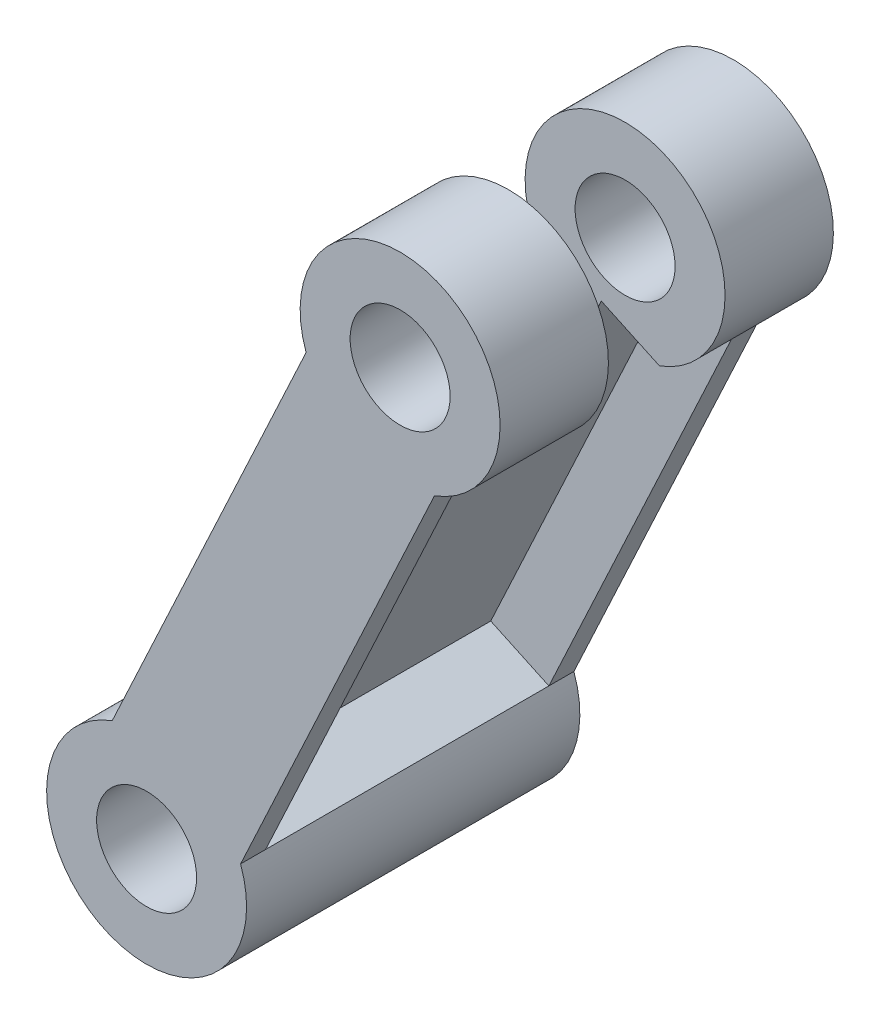
from build123d import *

# Parameters (mm, degrees)
BOSS_EXTRUDE1_DEPTH     = 100
CUT_EXTRUDE1_DEPTH      = 452.895569028
CUT_EXTRUDE1_DEPTH_BACK = 452.895569028
SKETCH2_R               = 30
SKETCH9_R               = 60
CUT_EXTRUDE4_DEPTH      = 35
CUT_EXTRUDE5_DEPTH      = 457.59902747
SKETCH12_W              = 170
SKETCH12_H              = 275.29462827
CUT_EXTRUDE6_DEPTH      = 38.5


with BuildPart() as part:
    # Sketch1 → Boss-Extrude1 (new, symmetric)
    with BuildSketch(Plane.XY):
        with BuildLine():
            Line((56.417099429, 20.423292878), (172.761636695, 269.924958208))
            ThreePointArc((172.761636695, 269.924958208), (177.499669931, 380.649270555), (95.725474797, 305.847510456))
            Line((95.725474797, 305.847510456), (-20.619062469, 56.345845126))
            ThreePointArc((-20.619062469, 56.345845126), (-25.357095704, -54.378467222), (56.417099429, 20.423292878))
        make_face()
    extrude(amount=BOSS_EXTRUDE1_DEPTH, both=True)

    # Sketch2 → Cut-Extrude1 (cut, two sides: drawn at the far end of the back side and taken through both)
    with BuildSketch(Plane.XY.offset(-CUT_EXTRUDE1_DEPTH_BACK)):
        Circle(SKETCH2_R)
        with Locations((152.142574227, 326.270803333)):
            Circle(SKETCH2_R)
    extrude(amount=CUT_EXTRUDE1_DEPTH + CUT_EXTRUDE1_DEPTH_BACK, mode=Mode.SUBTRACT)

    # Sketch9 → Cut-Extrude4 (cut, symmetric)
    with BuildSketch(Plane.XY):
        with Locations((152.142574227, 326.270803333)):
            Circle(SKETCH9_R)
    extrude(amount=CUT_EXTRUDE4_DEPTH, both=True, mode=Mode.SUBTRACT)

    # Sketch10 → Cut-Extrude5 (cut, through all)
    with BuildSketch(Plane(origin=(-38.518080949, 17.961276124, 0), x_dir=(0, 0, 1), z_dir=(-0.906307787036651, 0.42261826174069733, 0))):
        with BuildLine():
            Line((-35, 317.647314135), (-35, 272.647314135))
            ThreePointArc((-35, 272.647314135), (-32.071067812, 265.576246323), (-25, 262.647314135))
            Line((-25, 262.647314135), (0, 262.647314135))
            Line((0, 262.647314135), (25, 262.647314135))
            ThreePointArc((25, 262.647314135), (32.071067812, 265.576246323), (35, 272.647314135))
            Line((35, 272.647314135), (35, 317.647314135))
            Line((35, 317.647314135), (-35, 317.647314135))
        make_face()
    extrude(amount=-CUT_EXTRUDE5_DEPTH, mode=Mode.SUBTRACT)

    # Sketch12 → Cut-Extrude6 (cut)
    with BuildSketch(Plane(origin=(-38.518080949, 17.961276124, 0), x_dir=(0, 0, 1), z_dir=(-0.906307787036651, 0.42261826174069733, 0))):
        with Locations((0, 180)):
            Rectangle(SKETCH12_W, SKETCH12_H)
    cut_extrude6 = extrude(amount=-CUT_EXTRUDE6_DEPTH, mode=Mode.SUBTRACT)

    # Mirror1: Cut-Extrude6 across plane
    add(cut_extrude6.mirror(Plane(origin=(0, 0, 0), x_dir=(0, 0, 1), z_dir=(-0.906307787036651, 0.42261826174069733, 0))), mode=Mode.SUBTRACT)


solid = part.part
